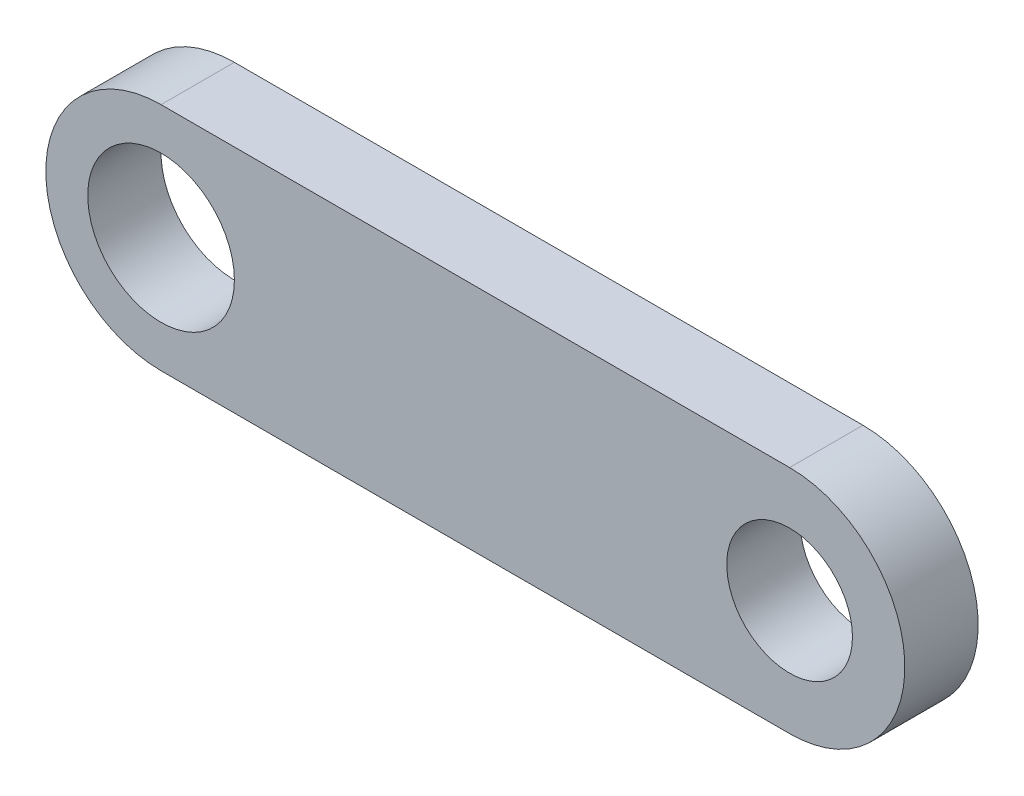
from build123d import *

# Parameters (mm, degrees)
SKETCH1_R           = 3.5
SKETCH1_R_2         = 3
BOSS_EXTRUDE1_DEPTH = 3.5


with BuildPart() as part:
    # Sketch1 → Boss-Extrude1 (new body)
    with BuildSketch(Plane.XY):
        with BuildLine():
            Line((0, 5.5), (30, 5.5))
            ThreePointArc((30, 5.5), (35.5, 0), (30, -5.5))
            Line((30, -5.5), (0, -5.5))
            ThreePointArc((0, -5.5), (-5.5, 0), (0, 5.5))
        make_face()
        Circle(SKETCH1_R, mode=Mode.SUBTRACT)
        with Locations((30, 0)):
            Circle(SKETCH1_R_2, mode=Mode.SUBTRACT)
    extrude(amount=BOSS_EXTRUDE1_DEPTH)


solid = part.part
